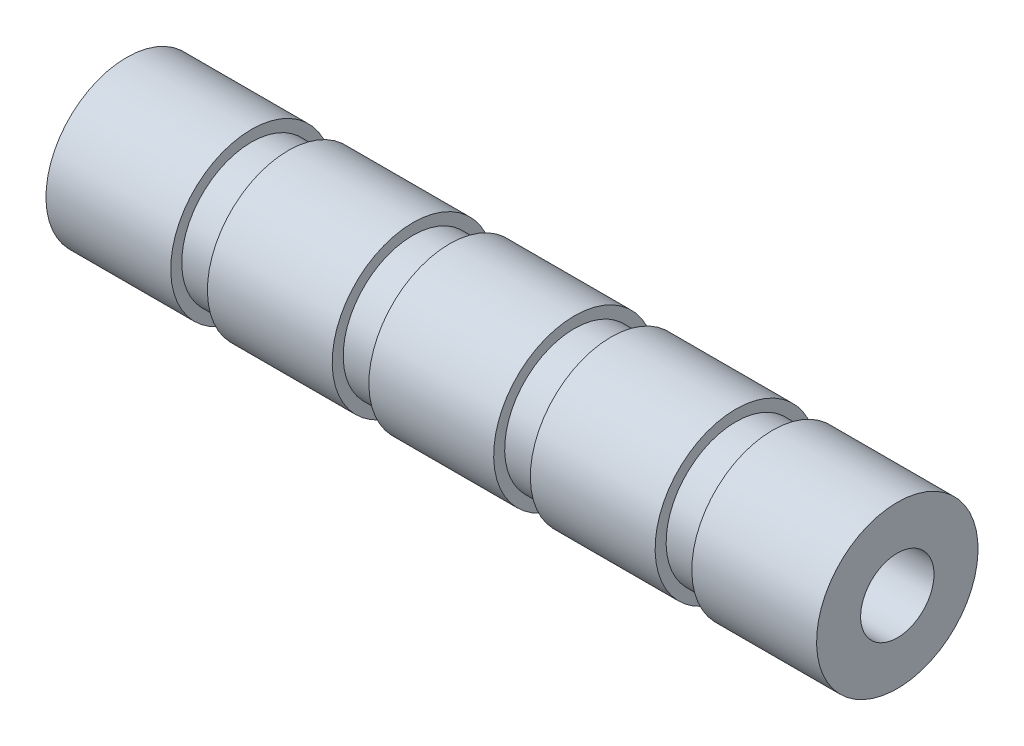
from build123d import *

# Parameters (mm, degrees)
SKETCH3_R          = 5
CUT_EXTRUDE2_DEPTH = 107.856211799


with BuildPart() as part:
    # Sketch1 → Revolve2 (revolve)
    with BuildSketch(Plane.XY, mode=Mode.PRIVATE) as revolve2_sk:
        Polygon((-6, -5.5), (11, -5.5), (11, 5.5), (-6, 5.5), (-11, 5.5), (-33, 5.5), (-55, 5.5), (-77, 5.5), (-94, 5.5), (-94, -5.5), (-77, -5.5), (-77, -4), (-72, -4), (-72, -5.5), (-55, -5.5), (-55, -4), (-50, -4), (-50, -5.5), (-33, -5.5), (-33, -4), (-28, -4), (-28, -5.5), (-11, -5.5), (-11, -4), (-6, -4), align=None)
    revolve(revolve2_sk.sketch.rotate(Axis((-33, 5.5, 0), (-1, 0, 0)), 180), axis=Axis((-33, 5.5, 0), (-1, 0, 0)))

    # Sketch3 → Cut-Extrude2 (cut, through all)
    with BuildSketch(Plane.ZY.offset(94)):
        with Locations(Location((0, 5.5, 0), (0, 0, 270))):
            Circle(SKETCH3_R)
    extrude(amount=-CUT_EXTRUDE2_DEPTH, mode=Mode.SUBTRACT)


solid = part.part
